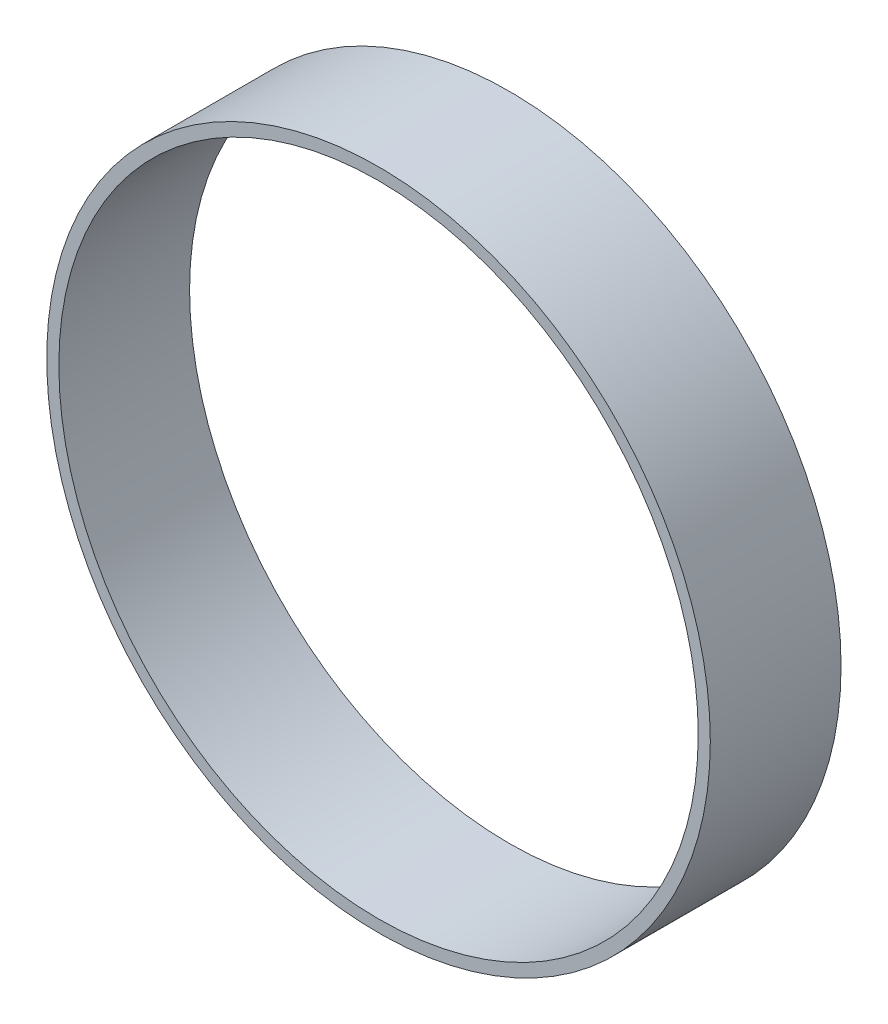
from build123d import *

# Parameters (mm, degrees)
SKETCH1_R           = 13.45
SKETCH1_R_2         = 12.96
BOSS_EXTRUDE1_DEPTH = 5.3


with BuildPart() as part:
    # Sketch1 → Boss-Extrude1 (new body)
    with BuildSketch(Plane.XY):
        Circle(SKETCH1_R)
        Circle(SKETCH1_R_2, mode=Mode.SUBTRACT)
    extrude(amount=BOSS_EXTRUDE1_DEPTH)


solid = part.part
